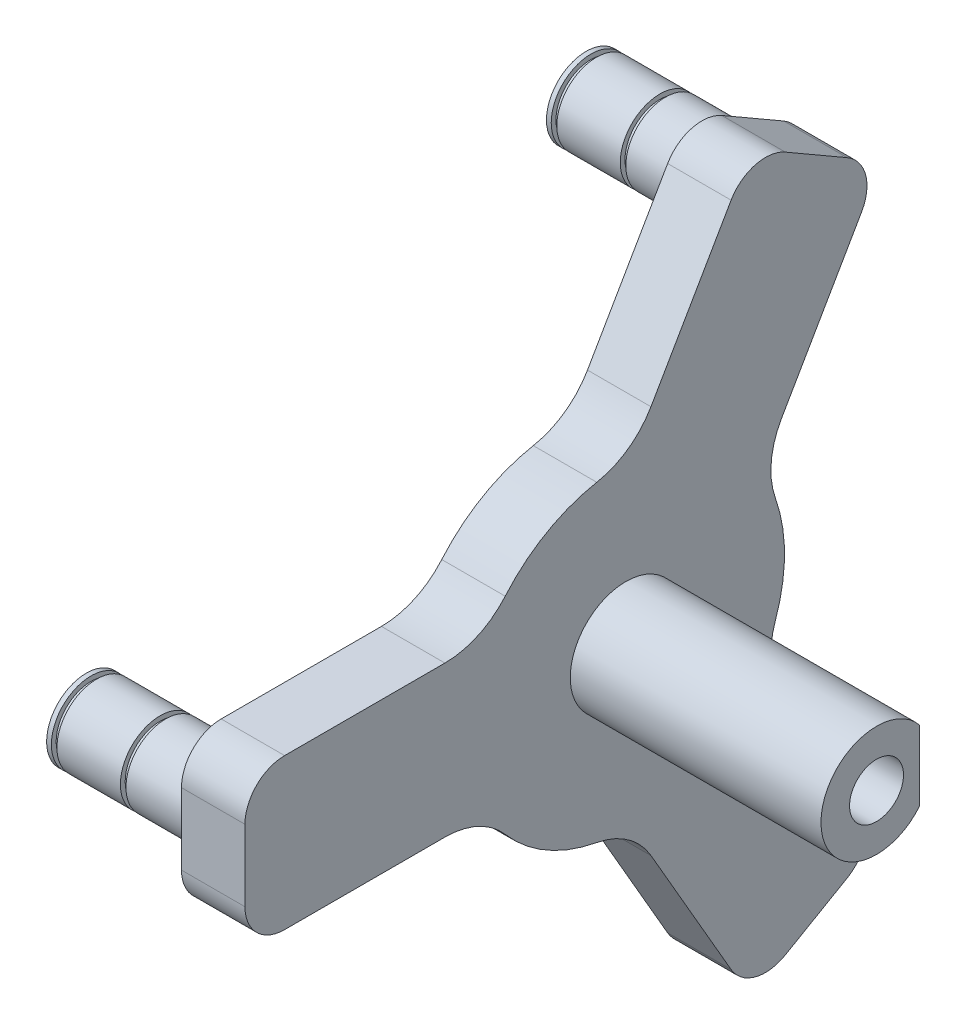
from build123d import *

# Parameters (mm, degrees)
BOSS_EXTRUDE2_DEPTH = 8
FILLET1_R           = 10
FILLET3_R           = 5
FILLET4_R           = 5
SKETCH3_R           = 5
BOSS_EXTRUDE3_DEPTH = 10
SKETCH2_R           = 5
BOSS_EXTRUDE4_DEPTH = 18
SKETCH4_R           = 7
BOSS_EXTRUDE5_DEPTH = 31.6
CUT_EXTRUDE1_START  = -8
CUT_EXTRUDE1_DEPTH  = 8
SKETCH7_W           = 0.7
SKETCH7_H           = 1.2
CIRPATTERN1_COUNT   = 3
SKETCH8_R           = 3.4
CUT_EXTRUDE2_DEPTH  = 14


with BuildPart() as part:
    # Sketch1 → Boss-Extrude2 (new body)
    with BuildSketch(Plane.YZ):
        with BuildLine():
            Line((-19.991801075, -0.572616617), (-46.319219382, -15.772758664))
            Line((-46.319219382, -15.772758664), (-36.819219382, -32.227241336))
            Line((-36.819219382, -32.227241336), (-10.491801075, -17.027099289))
            ThreePointArc((-10.491801075, -17.027099289), (0, -20), (10.491801075, -17.027099289))
            Line((10.491801075, -17.027099289), (36.819219382, -32.227241336))
            Line((36.819219382, -32.227241336), (46.319219382, -15.772758664))
            Line((46.319219382, -15.772758664), (19.991801075, -0.572616617))
            ThreePointArc((19.991801075, -0.572616617), (17.320508076, 10), (9.5, 17.599715907))
            Line((9.5, 17.599715907), (9.5, 48))
            Line((9.5, 48), (-9.5, 48))
            Line((-9.5, 48), (-9.5, 17.599715907))
            ThreePointArc((-9.5, 17.599715907), (-17.320508076, 10), (-19.991801075, -0.572616617))
        make_face()
    extrude(amount=BOSS_EXTRUDE2_DEPTH)

    # Fillet1
    fillet1_edges = [part.edges().sort_by_distance(p)[0] for p in [
        (4, 9.5, 17.599715907),
        (4, 19.991801075, -0.572616617),
        (4, 10.491801075, -17.027099289),
        (4, -10.491801075, -17.027099289),
        (4, -19.991801075, -0.572616617),
        (4, -9.5, 17.599715907),
    ]]
    fillet(fillet1_edges, radius=FILLET1_R)

    # Fillet3
    fillet3_edges = [part.edges().sort_by_distance(p)[0] for p in [
        (4, -9.5, 48),
        (4, 9.5, 48),
    ]]
    fillet(fillet3_edges, radius=FILLET3_R)

    # Fillet4
    fillet4_edges = [part.edges().sort_by_distance(p)[0] for p in [
        (4, 46.319219382, -15.772758664),
        (4, 36.819219382, -32.227241336),
        (4, -36.819219382, -32.227241336),
        (4, -46.319219382, -15.772758664),
    ]]
    fillet(fillet4_edges, radius=FILLET4_R)

    # Sketch3 → Boss-Extrude3 (add)
    with BuildSketch(Plane(origin=(0, 0, 0), x_dir=(0, -1, 0), z_dir=(-1, 0, 0))):
        with Locations(Location((0, 0, 0), (0, 0, 270))):
            Circle(SKETCH3_R)
    extrude(amount=BOSS_EXTRUDE3_DEPTH)

    # Sketch2 → Boss-Extrude4 (add)
    with BuildSketch(Plane(origin=(0, 0, 0), x_dir=(0, -1, 0), z_dir=(-1, 0, 0))):
        with Locations(Location((0, 42, 0), (0, 0, 270))):
            Circle(SKETCH2_R)
        with Locations(Location((-36.373066959, -21, 0), (0, 0, 270))):
            Circle(SKETCH2_R)
        with Locations(Location((36.373066959, -21, 0), (0, 0, 270))):
            Circle(SKETCH2_R)
    extrude(amount=BOSS_EXTRUDE4_DEPTH)

    # Sketch4 → Boss-Extrude5 (add)
    with BuildSketch(Plane.YZ.offset(8)):
        with Locations(Location((0, 0, 0), (0, 0, 270))):
            Circle(SKETCH4_R)
    extrude(amount=BOSS_EXTRUDE5_DEPTH)

    # Sketch5 → Cut-Extrude1 (cut)
    with BuildSketch(Plane.YZ.offset(39.6).offset(CUT_EXTRUDE1_START)):
        with BuildLine():
            Line((-4.45, -5.403471107), (4.45, -5.403471107))
            ThreePointArc((4.45, -5.403471107), (0, -7), (-4.45, -5.403471107))
        make_face()
    extrude(amount=CUT_EXTRUDE1_DEPTH, mode=Mode.SUBTRACT)

    # Sketch7 → Cut-Revolve1 (revolve, cut)
    with BuildSketch(Plane(origin=(0, 0, 0), x_dir=(-1, 0, 0), z_dir=(0, 1, 0))):
        with Locations((8.35, 47)):
            Rectangle(SKETCH7_W, SKETCH7_H)
        with Locations((17.05, 47)):
            Rectangle(SKETCH7_W, SKETCH7_H)
    cut_revolve1 = revolve(axis=Axis((-21.815535784, 0, 42), (1, 0, 0)), mode=Mode.SUBTRACT)

    # CirPattern1: Cut-Revolve1 ×3 about axis
    cirpattern1_axis = Axis((0, 0, 0), (1, 0, 0))
    for i in range(1, CIRPATTERN1_COUNT):
        add(cut_revolve1.rotate(cirpattern1_axis, i * 360 / CIRPATTERN1_COUNT), mode=Mode.SUBTRACT)

    # Sketch8 → Cut-Extrude2 (cut)
    with BuildSketch(Plane.YZ.offset(39.6)):
        with Locations(Location((0, 0, 0), (0, 0, 270))):
            Circle(SKETCH8_R)
    extrude(amount=-CUT_EXTRUDE2_DEPTH, mode=Mode.SUBTRACT)


solid = part.part
